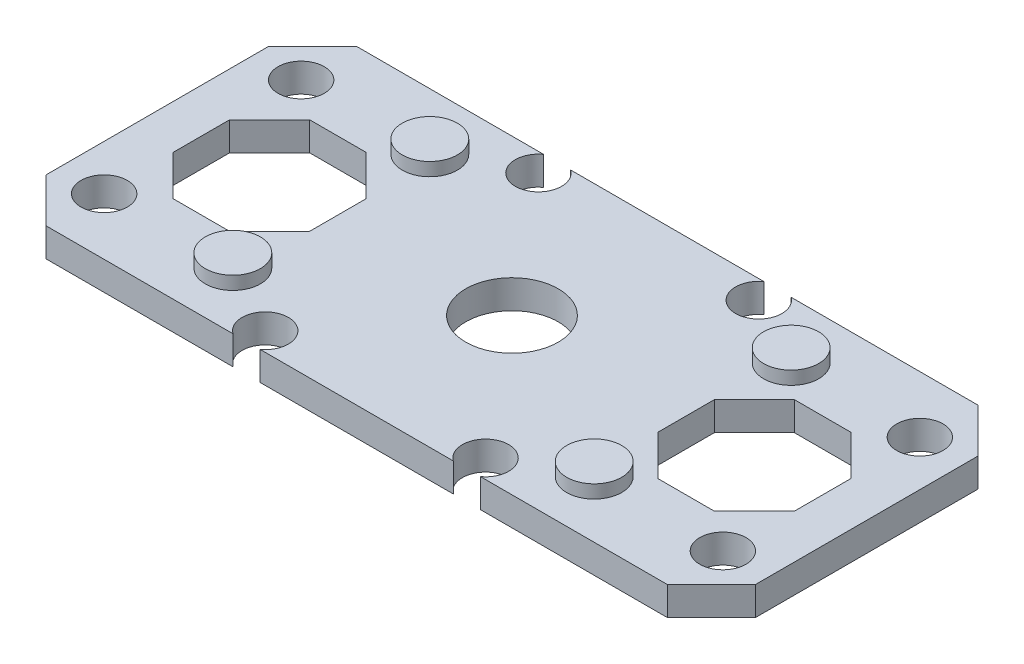
from build123d import *

# Parameters (mm, degrees)
SKETCH1_R           = 1.3335
SKETCH1_R_2         = 1.5875
BOSS_EXTRUDE1_DEPTH = 1.651
CHAMFER1_SIZE       = 2.54
SKETCH1_2_R         = 1.5875
BOSS_EXTRUDE2_DEPTH = 2.413
SKETCH1_3_R         = 1.5875
CUT_EXTRUDE1_DEPTH  = 0.889
SKETCH3_R           = 2.667
CUT_EXTRUDE3_DEPTH  = 23.382376376


with BuildPart() as part:
    # Sketch1 → Boss-Extrude1 (new body)
    with BuildSketch(Plane(origin=(0, 0, 0), x_dir=(1, 0, 0), z_dir=(0, 1, 0))):
        with BuildLine():
            Line((-5.567119422, 8.9535), (5.567119422, 8.9535))
            ThreePointArc((5.567119422, 8.9535), (6.35, 6.5405), (7.132880578, 8.9535))
            Line((7.132880578, 8.9535), (20.447, 8.9535))
            Line((20.447, 8.9535), (20.447, -8.9535))
            Line((20.447, -8.9535), (7.132880578, -8.9535))
            ThreePointArc((7.132880578, -8.9535), (6.35, -6.5405), (5.567119422, -8.9535))
            Line((5.567119422, -8.9535), (-5.567119422, -8.9535))
            ThreePointArc((-5.567119422, -8.9535), (-6.35, -6.5405), (-7.132880578, -8.9535))
            Line((-7.132880578, -8.9535), (-20.447, -8.9535))
            Line((-20.447, -8.9535), (-20.447, 8.9535))
            Line((-20.447, 8.9535), (-7.132880578, 8.9535))
            ThreePointArc((-7.132880578, 8.9535), (-6.35, 6.5405), (-5.567119422, 8.9535))
        make_face()
        with Locations((-17.8308, 5.6769)):
            Circle(SKETCH1_R, mode=Mode.SUBTRACT)
        with Locations((17.8308, 5.6769)):
            Circle(SKETCH1_R, mode=Mode.SUBTRACT)
        with Locations((17.8308, -5.6769)):
            Circle(SKETCH1_R, mode=Mode.SUBTRACT)
        with Locations((-17.8308, -5.6769)):
            Circle(SKETCH1_R, mode=Mode.SUBTRACT)
        with Locations((-10.414, 5.6769)):
            Circle(SKETCH1_R_2, mode=Mode.SUBTRACT)
        with Locations((10.414, 5.6769)):
            Circle(SKETCH1_R_2, mode=Mode.SUBTRACT)
        with Locations((10.414, -5.6769)):
            Circle(SKETCH1_R_2, mode=Mode.SUBTRACT)
        with Locations((-10.414, -5.6769)):
            Circle(SKETCH1_R_2, mode=Mode.SUBTRACT)
    extrude(amount=BOSS_EXTRUDE1_DEPTH)

    # Chamfer1
    chamfer1_edges = [part.edges().sort_by_distance(p)[0] for p in [
        (-20.447, 0.8255, 8.9535),
        (-20.447, 0.8255, -8.9535),
        (20.447, 0.8255, -8.9535),
        (20.447, 0.8255, 8.9535),
    ]]
    chamfer(chamfer1_edges, length=CHAMFER1_SIZE)

    # Sketch1<2> → Boss-Extrude2 (add)
    with BuildSketch(Plane(origin=(0, 0, 0), x_dir=(1, 0, 0), z_dir=(0, 1, 0))):
        with Locations((-10.414, 5.6769)):
            Circle(SKETCH1_2_R)
        with Locations((10.414, 5.6769)):
            Circle(SKETCH1_2_R)
        with Locations((10.414, -5.6769)):
            Circle(SKETCH1_2_R)
        with Locations((-10.414, -5.6769)):
            Circle(SKETCH1_2_R)
    extrude(amount=BOSS_EXTRUDE2_DEPTH)

    # Sketch1<3> → Cut-Extrude1 (cut)
    with BuildSketch(Plane(origin=(0, 0, 0), x_dir=(1, 0, 0), z_dir=(0, 1, 0))):
        with Locations((-10.414, 5.6769)):
            Circle(SKETCH1_3_R)
        with Locations((10.414, 5.6769)):
            Circle(SKETCH1_3_R)
        with Locations((10.414, -5.6769)):
            Circle(SKETCH1_3_R)
        with Locations((-10.414, -5.6769)):
            Circle(SKETCH1_3_R)
    extrude(amount=CUT_EXTRUDE1_DEPTH, mode=Mode.SUBTRACT)

    # Sketch3 → Cut-Extrude3 (cut, through all)
    with BuildSketch(Plane(origin=(0, 1.651, 0), x_dir=(1, 0, 0), z_dir=(0, 1, 0))):
        Circle(SKETCH3_R)
        Polygon((-10.033, 1.630758795), (-12.339241205, 3.937), (-15.600758795, 3.937), (-17.907, 1.630758795), (-17.907, -1.630758795), (-15.600758795, -3.937), (-12.339241205, -3.937), (-10.033, -1.630758795), align=None)
        Polygon((17.907, 1.630758795), (15.600758795, 3.937), (12.339241205, 3.937), (10.033, 1.630758795), (10.033, -1.630758795), (12.339241205, -3.937), (15.600758795, -3.937), (17.907, -1.630758795), align=None)
    extrude(amount=-CUT_EXTRUDE3_DEPTH, mode=Mode.SUBTRACT)


solid = part.part
